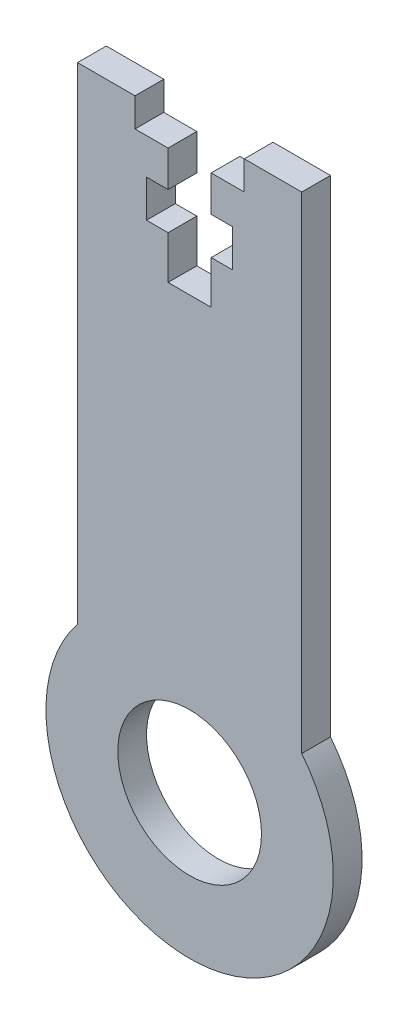
from build123d import *

# Parameters (mm, degrees)
SKETCH_1_R      = 5
EXTRUDE_1_DEPTH = 2


with BuildPart() as part:
    # 草图1 → 凸台-拉伸1 (new body)
    with BuildSketch(Plane.XY):
        with BuildLine():
            Line((0.753104923, 26.857612039), (3.053104923, 26.857612039))
            Line((3.053104923, 26.857612039), (3.053104923, 28.857612039))
            Line((3.053104923, 28.857612039), (7.053104923, 28.857612039))
            Line((7.053104923, 28.857612039), (7.053104923, -4.984592822))
            ThreePointArc((7.053104923, -4.984592822), (-0.746895077, -21.242387961), (-8.546895077, -4.984592822))
            Line((-8.546895077, -4.984592822), (-8.546895077, 28.857612039))
            Line((-8.546895077, 28.857612039), (-4.546895077, 28.857612039))
            Line((-4.546895077, 28.857612039), (-4.546895077, 26.857612039))
            Line((-4.546895077, 26.857612039), (-2.246895077, 26.857612039))
            Line((-2.246895077, 26.857612039), (-2.246895077, 24.357612039))
            Line((-2.246895077, 24.357612039), (-3.746895077, 24.357612039))
            Line((-3.746895077, 24.357612039), (-3.746895077, 21.757612039))
            Line((-3.746895077, 21.757612039), (-2.246895077, 21.757612039))
            Line((-2.246895077, 21.757612039), (-2.246895077, 18.757612039))
            Line((-2.246895077, 18.757612039), (0.753104923, 18.757612039))
            Line((0.753104923, 18.757612039), (0.753104923, 21.757612039))
            Line((0.753104923, 21.757612039), (2.253104923, 21.757612039))
            Line((2.253104923, 21.757612039), (2.253104923, 24.357612039))
            Line((2.253104923, 24.357612039), (0.753104923, 24.357612039))
            Line((0.753104923, 24.357612039), (0.753104923, 26.857612039))
        make_face()
        with Locations((-0.746895077, -11.242387961)):
            Circle(SKETCH_1_R, mode=Mode.SUBTRACT)
    extrude(amount=EXTRUDE_1_DEPTH)


solid = part.part
